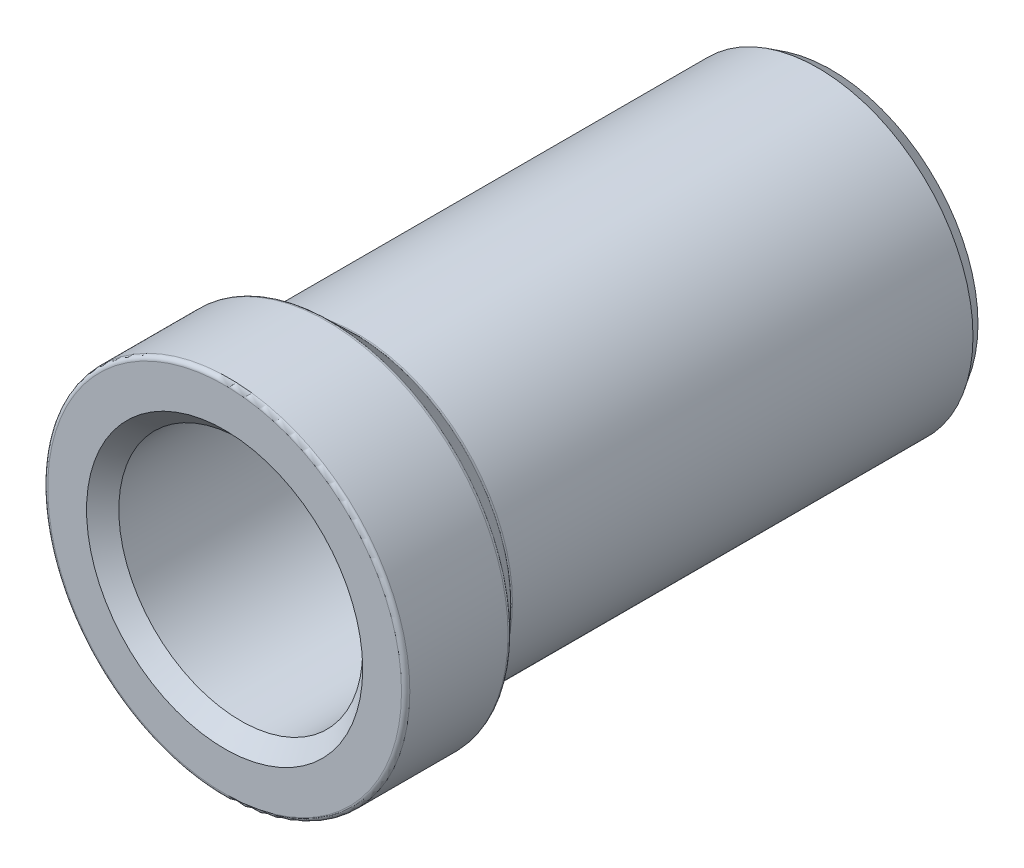
from build123d import *

# Parameters (mm, degrees)
SKETCH1_R                           = 18.923
BOSS_EXTRUDE1_DEPTH                 = 74.041
FILLET1_R                           = 0.508
CHAMFER1_SIZE                       = 1.016
CHAMFER1_SIZE2                      = 1.625939882
SKETCH4_R                           = 14.859
CUT_EXTRUDE1_DEPTH                  = 12.7
CHAMFER2_SIZE                       = 0.762
F_1_1_4_12_TAPPED_HOLE1_D           = 29.76626
F_1_1_4_12_TAPPED_HOLE1_DEPTH       = 61.341
F_1_1_4_12_TAPPED_HOLE1_CSINK_D     = 33.7058
F_1_1_4_12_TAPPED_HOLE1_CSINK_ANGLE = 90


with BuildPart() as part:
    # Sketch1 → Boss-Extrude1 (new body)
    with BuildSketch(Plane.XY):
        Circle(SKETCH1_R)
    extrude(amount=BOSS_EXTRUDE1_DEPTH)

    # Sketch3 → Revolve1 (revolve)
    with BuildSketch(Plane(origin=(0, 0, 0), x_dir=(1, 0, 0), z_dir=(0, 1, 0))):
        Polygon((0, -74.041), (22.098, -74.041), (22.098, -61.341), (18.923, -58.039), (0, -58.039), align=None)
    revolve(axis=Axis((0, 0, 0), (0, 0, 1)))

    # Fillet1
    fillet1_edges = [part.edges().sort_by_distance(p)[0] for p in [
        (-18.923, 0, 58.039),
        (-22.098, 0, 74.041),
        (-22.098, 0, 61.341),
    ]]
    fillet(fillet1_edges, radius=FILLET1_R)

    # Chamfer1
    chamfer1_edges = [part.edges().sort_by_distance(p)[0] for p in [
        (-18.923, 0, 0),
    ]]
    chamfer1_side = [part.faces().sort_by_distance(p)[0] for p in [
        (0, 0, 0),
    ]]
    chamfer(chamfer1_edges, length=CHAMFER1_SIZE, length2=CHAMFER1_SIZE2, reference=chamfer1_side[0])

    # Sketch4 → Cut-Extrude1 (cut)
    with BuildSketch(Plane(origin=(0, 0, 0), x_dir=(-1, 0, 0), z_dir=(0, 0, -1))):
        Circle(SKETCH4_R)
    extrude(amount=-CUT_EXTRUDE1_DEPTH, mode=Mode.SUBTRACT)

    # Chamfer2
    chamfer2_edges = [part.edges().sort_by_distance(p)[0] for p in [
        (14.859, 0, 0),
    ]]
    chamfer(chamfer2_edges, length=CHAMFER2_SIZE)

    # 1-1/4-12 Tapped Hole1
    with Locations(Plane.XY.offset(74.041)):
        with Locations((0, 0)):
            CounterSinkHole(F_1_1_4_12_TAPPED_HOLE1_D / 2, F_1_1_4_12_TAPPED_HOLE1_CSINK_D / 2, depth=F_1_1_4_12_TAPPED_HOLE1_DEPTH, counter_sink_angle=F_1_1_4_12_TAPPED_HOLE1_CSINK_ANGLE)


solid = part.part
